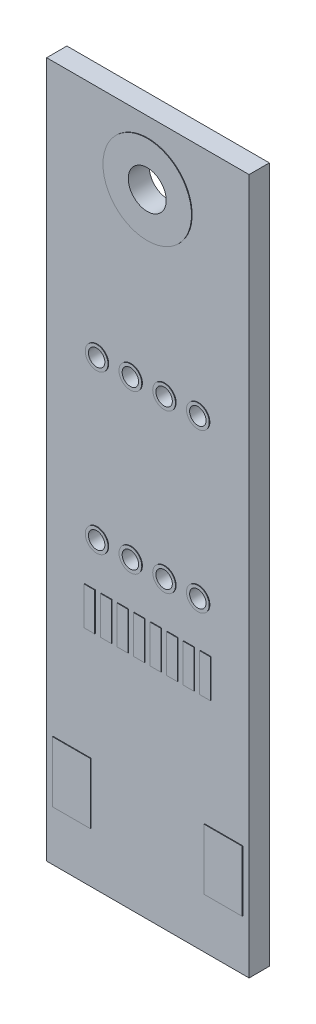
from build123d import *

# Parameters (mm, degrees)
SKETCH1_W           = 16
SKETCH1_H           = 55
SKETCH1_R           = 1.5
BOSS_EXTRUDE1_DEPTH = 1.6
SKETCH3_R           = 0.65
CUT_EXTRUDE1_DEPTH  = 29.684664893
BOSS_EXTRUDE3_START = 0.05
SKETCH4_R           = 0.9
SKETCH4_R_2         = 0.65
SKETCH4_R_3         = 3.5
SKETCH4_R_4         = 1.5
SKETCH4_W           = 0.85
SKETCH4_H           = 3
SKETCH4_W_2         = 3
SKETCH4_H_2         = 4.8
BOSS_EXTRUDE3_DEPTH = 0.05


with BuildPart() as part:
    # Sketch1 → Boss-Extrude1 (new body)
    with BuildSketch(Plane.XY):
        Rectangle(SKETCH1_W, SKETCH1_H)
        with Locations((0, 22.5)):
            Circle(SKETCH1_R, mode=Mode.SUBTRACT)
    extrude(amount=BOSS_EXTRUDE1_DEPTH)

    # Sketch3 → Cut-Extrude1 (cut, through all)
    with BuildSketch(Plane.XY.offset(1.6)):
        with Locations((-4, -3.5)):
            Circle(SKETCH3_R)
        with Locations((-1.333333333, -3.5)):
            Circle(SKETCH3_R)
        with Locations((1.333333333, -3.5)):
            Circle(SKETCH3_R)
        with Locations((4, -3.5)):
            Circle(SKETCH3_R)
        with Locations((-4, 9)):
            Circle(SKETCH3_R)
        with Locations((-1.333333333, 9)):
            Circle(SKETCH3_R)
        with Locations((1.333333333, 9)):
            Circle(SKETCH3_R)
        with Locations((4, 9)):
            Circle(SKETCH3_R)
    extrude(amount=-CUT_EXTRUDE1_DEPTH, mode=Mode.SUBTRACT)

    # Sketch4 → Boss-Extrude3 (add)
    # profile 1 of 19: a face of its own
    with BuildSketch(Plane.XY.offset(1.6).offset(BOSS_EXTRUDE3_START)):
        with Locations(Location((-4, 9, 0), (0, 0, 180))):
            Circle(SKETCH4_R)
        with Locations((-4, 9)):
            Circle(SKETCH4_R_2, mode=Mode.SUBTRACT)
    # profile 2 of 19: a face of its own
    with BuildSketch(Plane.XY.offset(1.6).offset(BOSS_EXTRUDE3_START)):
        with Locations(Location((-1.333333333, 9, 0), (0, 0, 180))):
            Circle(SKETCH4_R)
        with Locations((-1.333333333, 9)):
            Circle(SKETCH4_R_2, mode=Mode.SUBTRACT)
    # profile 3 of 19: a face of its own
    with BuildSketch(Plane.XY.offset(1.6).offset(BOSS_EXTRUDE3_START)):
        with Locations(Location((1.333333333, 9, 0), (0, 0, 180))):
            Circle(SKETCH4_R)
        with Locations((1.333333333, 9)):
            Circle(SKETCH4_R_2, mode=Mode.SUBTRACT)
    # profile 4 of 19: a face of its own
    with BuildSketch(Plane.XY.offset(1.6).offset(BOSS_EXTRUDE3_START)):
        with Locations(Location((4, 9, 0), (0, 0, 180))):
            Circle(SKETCH4_R)
        with Locations((4, 9)):
            Circle(SKETCH4_R_2, mode=Mode.SUBTRACT)
    # profile 5 of 19: a face of its own
    with BuildSketch(Plane.XY.offset(1.6).offset(BOSS_EXTRUDE3_START)):
        with Locations(Location((4, -3.5, 0), (0, 0, 180))):
            Circle(SKETCH4_R)
        with Locations((4, -3.5)):
            Circle(SKETCH4_R_2, mode=Mode.SUBTRACT)
    # profile 6 of 19: a face of its own
    with BuildSketch(Plane.XY.offset(1.6).offset(BOSS_EXTRUDE3_START)):
        with Locations(Location((1.333333333, -3.5, 0), (0, 0, 180))):
            Circle(SKETCH4_R)
        with Locations((1.333333333, -3.5)):
            Circle(SKETCH4_R_2, mode=Mode.SUBTRACT)
    # profile 7 of 19: a face of its own
    with BuildSketch(Plane.XY.offset(1.6).offset(BOSS_EXTRUDE3_START)):
        with Locations(Location((-1.333333333, -3.5, 0), (0, 0, 180))):
            Circle(SKETCH4_R)
        with Locations((-1.333333333, -3.5)):
            Circle(SKETCH4_R_2, mode=Mode.SUBTRACT)
    # profile 8 of 19: a face of its own
    with BuildSketch(Plane.XY.offset(1.6).offset(BOSS_EXTRUDE3_START)):
        with Locations(Location((-4, -3.5, 0), (0, 0, 180))):
            Circle(SKETCH4_R)
        with Locations((-4, -3.5)):
            Circle(SKETCH4_R_2, mode=Mode.SUBTRACT)
    # profile 9 of 19: a face of its own
    with BuildSketch(Plane.XY.offset(1.6).offset(BOSS_EXTRUDE3_START)):
        with Locations(Location((0, 22.5, 0), (0, 0, 180))):
            Circle(SKETCH4_R_3)
        with Locations((0, 22.5)):
            Circle(SKETCH4_R_4, mode=Mode.SUBTRACT)
    # profile 10 of 19: a face of its own
    with BuildSketch(Plane.XY.offset(1.6).offset(BOSS_EXTRUDE3_START)):
        with Locations((-4.575, -8.5)):
            Rectangle(SKETCH4_W, SKETCH4_H)
    # profile 11 of 19: a face of its own
    with BuildSketch(Plane.XY.offset(1.6).offset(BOSS_EXTRUDE3_START)):
        with Locations((-3.267857143, -8.5)):
            Rectangle(SKETCH4_W, SKETCH4_H)
    # profile 12 of 19: a face of its own
    with BuildSketch(Plane.XY.offset(1.6).offset(BOSS_EXTRUDE3_START)):
        with Locations((-1.960714286, -8.5)):
            Rectangle(SKETCH4_W, SKETCH4_H)
    # profile 13 of 19: a face of its own
    with BuildSketch(Plane.XY.offset(1.6).offset(BOSS_EXTRUDE3_START)):
        with Locations((-0.653571429, -8.5)):
            Rectangle(SKETCH4_W, SKETCH4_H)
    # profile 14 of 19: a face of its own
    with BuildSketch(Plane.XY.offset(1.6).offset(BOSS_EXTRUDE3_START)):
        with Locations((0.653571429, -8.5)):
            Rectangle(SKETCH4_W, SKETCH4_H)
    # profile 15 of 19: a face of its own
    with BuildSketch(Plane.XY.offset(1.6).offset(BOSS_EXTRUDE3_START)):
        with Locations((1.960714286, -8.5)):
            Rectangle(SKETCH4_W, SKETCH4_H)
    # profile 16 of 19: a face of its own
    with BuildSketch(Plane.XY.offset(1.6).offset(BOSS_EXTRUDE3_START)):
        with Locations((3.267857143, -8.5)):
            Rectangle(SKETCH4_W, SKETCH4_H)
    # profile 17 of 19: a face of its own
    with BuildSketch(Plane.XY.offset(1.6).offset(BOSS_EXTRUDE3_START)):
        with Locations((4.575, -8.5)):
            Rectangle(SKETCH4_W, SKETCH4_H)
    # profile 18 of 19: a face of its own
    with BuildSketch(Plane.XY.offset(1.6).offset(BOSS_EXTRUDE3_START)):
        with Locations((-6, -21.1)):
            Rectangle(SKETCH4_W_2, SKETCH4_H_2)
    # profile 19 of 19: a face of its own
    with BuildSketch(Plane.XY.offset(1.6).offset(BOSS_EXTRUDE3_START)):
        with Locations((6, -21.1)):
            Rectangle(SKETCH4_W_2, SKETCH4_H_2)
    extrude(amount=-BOSS_EXTRUDE3_DEPTH)


solid = part.part
